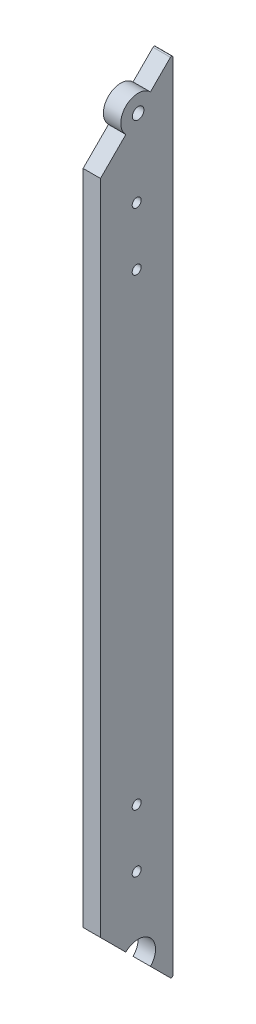
from build123d import *

# Parameters (mm, degrees)
BOSS_EXTRUDE1_DEPTH = 6
FILLET1_R           = 0.5
SKETCH4_R           = 6
BOSS_EXTRUDE2_DEPTH = 6
SKETCH3_R           = 2
SKETCH3_R_2         = 6
CUT_EXTRUDE1_DEPTH  = 284.694910827
CUT_EXTRUDE2_REACH  = 285.695
SKETCH6_R           = 1.55


with BuildPart() as part:
    # Sketch2 → Boss-Extrude1 (new body)
    with BuildSketch(Plane(origin=(0, 0, 0), x_dir=(0, 0, -1), z_dir=(1, 0, 0))):
        Polygon((-30.67492643, 30.67492643), (-30.67492643, 257.67492643), (-5.67492643, 282.67492643), (-5.67492643, 5.67492643), align=None)
    extrude(amount=BOSS_EXTRUDE1_DEPTH)

    # Fillet1
    fillet1_edges = [part.edges().sort_by_distance(p)[0] for p in [
        (3, 282.67492643, 5.67492643),
        (3, 5.67492643, 5.67492643),
    ]]
    fillet(fillet1_edges, radius=FILLET1_R)

    # Sketch4 → Boss-Extrude2 (add)
    with BuildSketch(Plane(origin=(6, 0, 0), x_dir=(0, 0, -1), z_dir=(1, 0, 0))):
        with Locations((-17.67492643, 270.67492643)):
            Circle(SKETCH4_R)
    extrude(amount=-BOSS_EXTRUDE2_DEPTH)

    # Sketch3 → Cut-Extrude1 (cut, through all)
    with BuildSketch(Plane(origin=(6, 0, 0), x_dir=(0, 0, -1), z_dir=(1, 0, 0))):
        with Locations((-17.67492643, 270.67492643)):
            Circle(SKETCH3_R)
        with Locations((-17.67492643, 17.67492643)):
            Circle(SKETCH3_R_2)
    extrude(amount=-CUT_EXTRUDE1_DEPTH, mode=Mode.SUBTRACT)

    # Sketch6 → Cut-Extrude2 (cut, up to next)
    with BuildSketch(Plane(origin=(6, 0, 0), x_dir=(0, 0, -1), z_dir=(1, 0, 0)), mode=Mode.PRIVATE) as cut_extrude2_sk1:
        with Locations((-18.17492643, 244.17492643)):
            Circle(SKETCH6_R)
    cut_extrude2_tool1 = extrude(cut_extrude2_sk1.sketch, amount=-CUT_EXTRUDE2_REACH, mode=Mode.PRIVATE) & part.part
    # Sketch6 → Cut-Extrude2 (cut, up to next)
    with BuildSketch(Plane(origin=(6, 0, 0), x_dir=(0, 0, -1), z_dir=(1, 0, 0)), mode=Mode.PRIVATE) as cut_extrude2_sk2:
        with Locations((-18.17492643, 224.17492643)):
            Circle(SKETCH6_R)
    cut_extrude2_tool2 = extrude(cut_extrude2_sk2.sketch, amount=-CUT_EXTRUDE2_REACH, mode=Mode.PRIVATE) & part.part
    # Sketch6 → Cut-Extrude2 (cut, up to next)
    with BuildSketch(Plane(origin=(6, 0, 0), x_dir=(0, 0, -1), z_dir=(1, 0, 0)), mode=Mode.PRIVATE) as cut_extrude2_sk3:
        with Locations((-18.17492643, 64.17492643)):
            Circle(SKETCH6_R)
    cut_extrude2_tool3 = extrude(cut_extrude2_sk3.sketch, amount=-CUT_EXTRUDE2_REACH, mode=Mode.PRIVATE) & part.part
    # Sketch6 → Cut-Extrude2 (cut, up to next)
    with BuildSketch(Plane(origin=(6, 0, 0), x_dir=(0, 0, -1), z_dir=(1, 0, 0)), mode=Mode.PRIVATE) as cut_extrude2_sk4:
        with Locations((-18.17492643, 44.17492643)):
            Circle(SKETCH6_R)
    cut_extrude2_tool4 = extrude(cut_extrude2_sk4.sketch, amount=-CUT_EXTRUDE2_REACH, mode=Mode.PRIVATE) & part.part
    add(cut_extrude2_tool1.solids().sort_by_distance((6, 244.174926, 18.174926))[0], mode=Mode.SUBTRACT)
    add(cut_extrude2_tool2.solids().sort_by_distance((6, 224.174926, 18.174926))[0], mode=Mode.SUBTRACT)
    add(cut_extrude2_tool3.solids().sort_by_distance((6, 64.174926, 18.174926))[0], mode=Mode.SUBTRACT)
    add(cut_extrude2_tool4.solids().sort_by_distance((6, 44.174926, 18.174926))[0], mode=Mode.SUBTRACT)


solid = part.part
